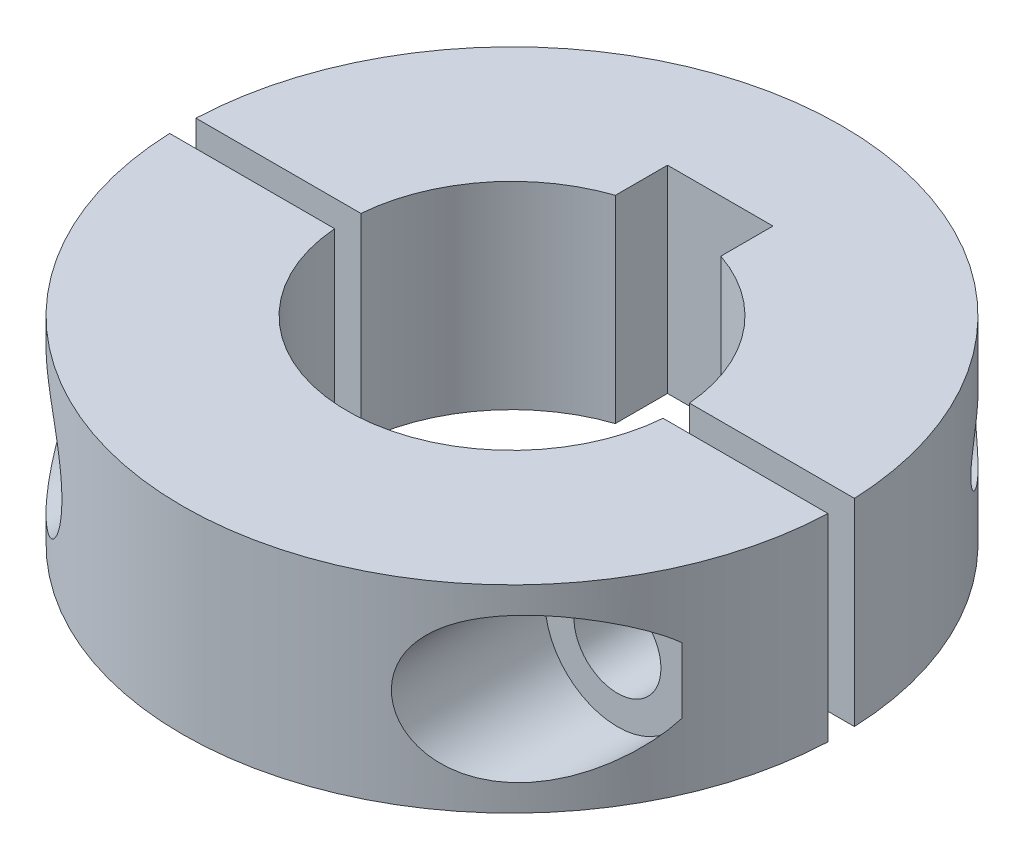
from build123d import *

# Parameters (mm, degrees)
SKETCH_1_R                  = 25
SKETCH_1_R_2                = 12.5
EXTRUDE_1_DEPTH             = 7.5
SKETCH_2_W                  = 55
SKETCH_2_H                  = 2
CUT_EXTRUDE_1_DEPTH         = 39.405728739
HOLE_WIZARD_M6_4_AT_2_COUNT = 2
HOLE_WIZARD_M6_4_AT_2_PITCH = 36
SKETCH_10_W                 = 2.5
SKETCH_10_H                 = 24
HOLE_WIZARD_M6_1_AT_2_COUNT = 2
HOLE_WIZARD_M6_1_AT_2_PITCH = 36
SKETCH_11_W                 = 8
SKETCH_11_H                 = 7
CUT_EXTRUDE_2_DEPTH         = 39.39270781


with BuildPart() as part:
    # 草圖1 → 填料-伸長1 (new, symmetric)
    with BuildSketch(Plane(origin=(0, 0, 0), x_dir=(1, 0, 0), z_dir=(0, 1, 0))):
        with Locations(Location((0, 0, 0), (0, 0, 270))):
            Circle(SKETCH_1_R)
        with Locations(Location((0, 0, 0), (0, 0, 270))):
            Circle(SKETCH_1_R_2, mode=Mode.SUBTRACT)
    extrude(amount=EXTRUDE_1_DEPTH, both=True)

    # 草圖2 → 除料-伸長1 (cut, through all)
    with BuildSketch(Plane(origin=(0, 7.5, 0), x_dir=(1, 0, 0), z_dir=(0, 1, 0))):
        Rectangle(SKETCH_2_W, SKETCH_2_H)
    extrude(amount=-CUT_EXTRUDE_1_DEPTH, mode=Mode.SUBTRACT)


with BuildPart() as cut_extrude_1_piece_1:
    # of the separate pieces the step leaves, piece 1, a body of its own (cut_extrude_1_pieces)
    add(part.part.solids().sort_by_distance((24.979991994, -7.5, -1))[0])

    # 草圖10 → M6 螺紋孔1 (revolve, cut)
    with BuildSketch(Plane(origin=(-18, 0, -1), x_dir=(0, -1, 0), z_dir=(1, 0, 0))):
        with Locations((1.25, 12)):
            Rectangle(SKETCH_10_W, SKETCH_10_H)
    hole_wizard_m6_1 = revolve(axis=Axis((-18, 0, 5.35), (0, 0, -1)), mode=Mode.SUBTRACT)

    # M6 螺紋孔1 at 2: M6 螺紋孔1 ×2
    with Locations(*[(i * HOLE_WIZARD_M6_1_AT_2_PITCH, 0, 0) for i in range(1, HOLE_WIZARD_M6_1_AT_2_COUNT)]):
        add(hole_wizard_m6_1, mode=Mode.SUBTRACT)

    # 草圖11 → 除料-伸長2 (cut, through all)
    with BuildSketch(Plane(origin=(0, 7.5, 0), x_dir=(1, 0, 0), z_dir=(0, 1, 0))):
        with Locations((0, 12.3)):
            Rectangle(SKETCH_11_W, SKETCH_11_H)
    extrude(amount=-CUT_EXTRUDE_2_DEPTH, mode=Mode.SUBTRACT)


with BuildPart() as cut_extrude_1_piece_2:
    # of the separate pieces the step leaves, piece 2, a body of its own (cut_extrude_1_pieces)
    add(part.part.solids().sort_by_distance((24.979991994, 7.5, 1))[0])

    # 草圖8 → M6 六角承窩頭蓋螺釘的柱孔4 (revolve, cut)
    with BuildSketch(Plane(origin=(-18, 0, 25), x_dir=(0, -1, 0), z_dir=(1, 0, 0))):
        Polygon((0, 0), (0, 42.349351573), (3.3, 42.349351573), (3.3, 15), (5.5, 15), (5.5, 0), align=None)
    hole_wizard_m6_4 = revolve(axis=Axis((-18, 0, 31.35), (0, 0, -1)), mode=Mode.SUBTRACT)

    # M6 六角承窩頭蓋螺釘的柱孔4 at 2: M6 六角承窩頭蓋螺釘的柱孔4 ×2
    with Locations(*[(i * HOLE_WIZARD_M6_4_AT_2_PITCH, 0, 0) for i in range(1, HOLE_WIZARD_M6_4_AT_2_COUNT)]):
        add(hole_wizard_m6_4, mode=Mode.SUBTRACT)


solid = Compound([cut_extrude_1_piece_1.part, cut_extrude_1_piece_2.part])
